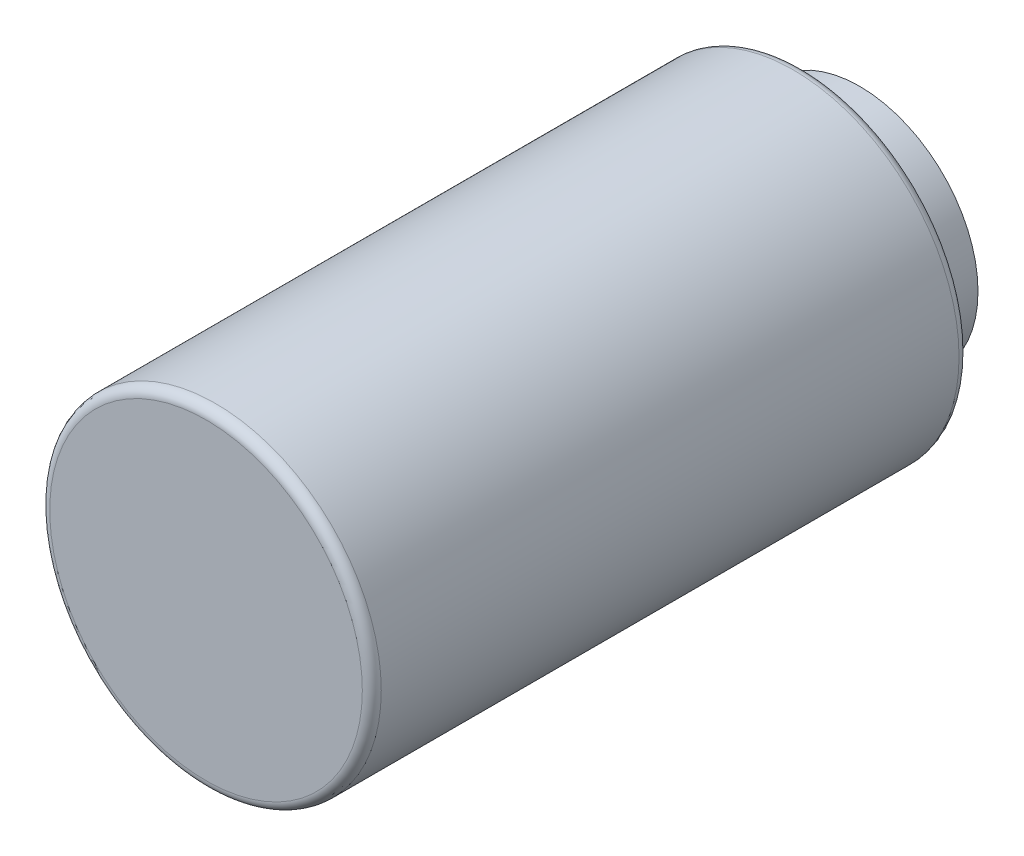
from build123d import *

# Parameters (mm, degrees)
SKETCH1_R           = 17.5
BOSS_EXTRUDE1_DEPTH = 63
SKETCH2_R           = 12.5
BOSS_EXTRUDE2_DEPTH = 6
FILLET1_R           = 1


with BuildPart() as part:
    # Sketch1 → Boss-Extrude1 (new body)
    with BuildSketch(Plane.XY):
        Circle(SKETCH1_R)
    extrude(amount=BOSS_EXTRUDE1_DEPTH)

    # Sketch2 → Boss-Extrude2 (add)
    with BuildSketch(Plane(origin=(0, 0, 0), x_dir=(-1, 0, 0), z_dir=(0, 0, -1))):
        with Locations(Location((0, 0, 0), (0, 0, 180))):
            Circle(SKETCH2_R)
    extrude(amount=BOSS_EXTRUDE2_DEPTH)

    # Fillet1
    fillet1_edges = [part.edges().sort_by_distance(p)[0] for p in [
        (-17.5, 0, 0),
        (-17.5, 0, 63),
    ]]
    fillet(fillet1_edges, radius=FILLET1_R)


solid = part.part
